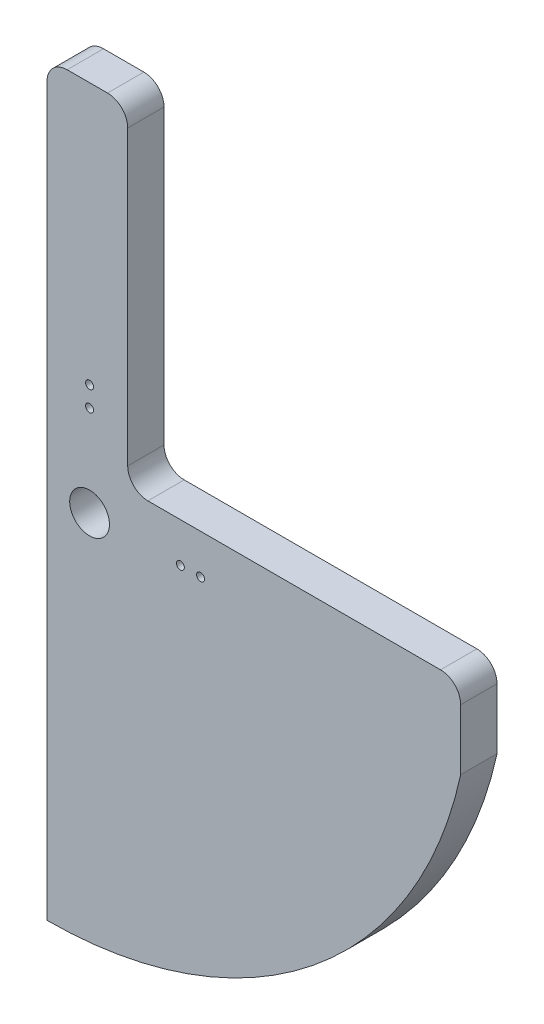
from build123d import *

# Parameters (mm, degrees)
SKETCH1_R           = 2.5
SKETCH1_R_2         = 0.5
BOSS_EXTRUDE2_DEPTH = 4.572


with BuildPart() as part:
    # Sketch1 → Boss-Extrude2 (new body)
    with BuildSketch(Plane.XY):
        with BuildLine():
            Line((4.800174543, 7.530126516), (4.800174543, 44.360126516))
            ThreePointArc((4.800174543, 44.360126516), (4.056225767, 46.15617774), (2.260174543, 46.900126516))
            Line((2.260174543, 46.900126516), (-2.819825457, 46.900126516))
            ThreePointArc((-2.819825457, 46.900126516), (-4.615876681, 46.15617774), (-5.359825457, 44.360126516))
            Line((-5.359825457, 44.360126516), (-5.359825457, -5.169873484))
            Line((-5.359825457, -5.169873484), (-5.359825457, -47.079873484))
            ThreePointArc((-5.359825457, -47.079873484), (28.060725855, -35.300861478), (46.710174543, -5.169873484))
            Line((46.710174543, -5.169873484), (46.710174543, -2.629873484))
            Line((46.710174543, -2.629873484), (46.710174543, 2.450126516))
            ThreePointArc((46.710174543, 2.450126516), (45.966225767, 4.24617774), (44.170174543, 4.990126516))
            Line((44.170174543, 4.990126516), (7.340174543, 4.990126516))
            ThreePointArc((7.340174543, 4.990126516), (5.544123319, 5.734075291), (4.800174543, 7.530126516))
        make_face()
        Circle(SKETCH1_R, mode=Mode.SUBTRACT)
        with Locations((0, 11.43)):
            Circle(SKETCH1_R_2, mode=Mode.SUBTRACT)
        with Locations((11.43, 0)):
            Circle(SKETCH1_R_2, mode=Mode.SUBTRACT)
        with Locations((0, 13.97)):
            Circle(SKETCH1_R_2, mode=Mode.SUBTRACT)
        with Locations((13.97, 0)):
            Circle(SKETCH1_R_2, mode=Mode.SUBTRACT)
    extrude(amount=BOSS_EXTRUDE2_DEPTH)


solid = part.part
